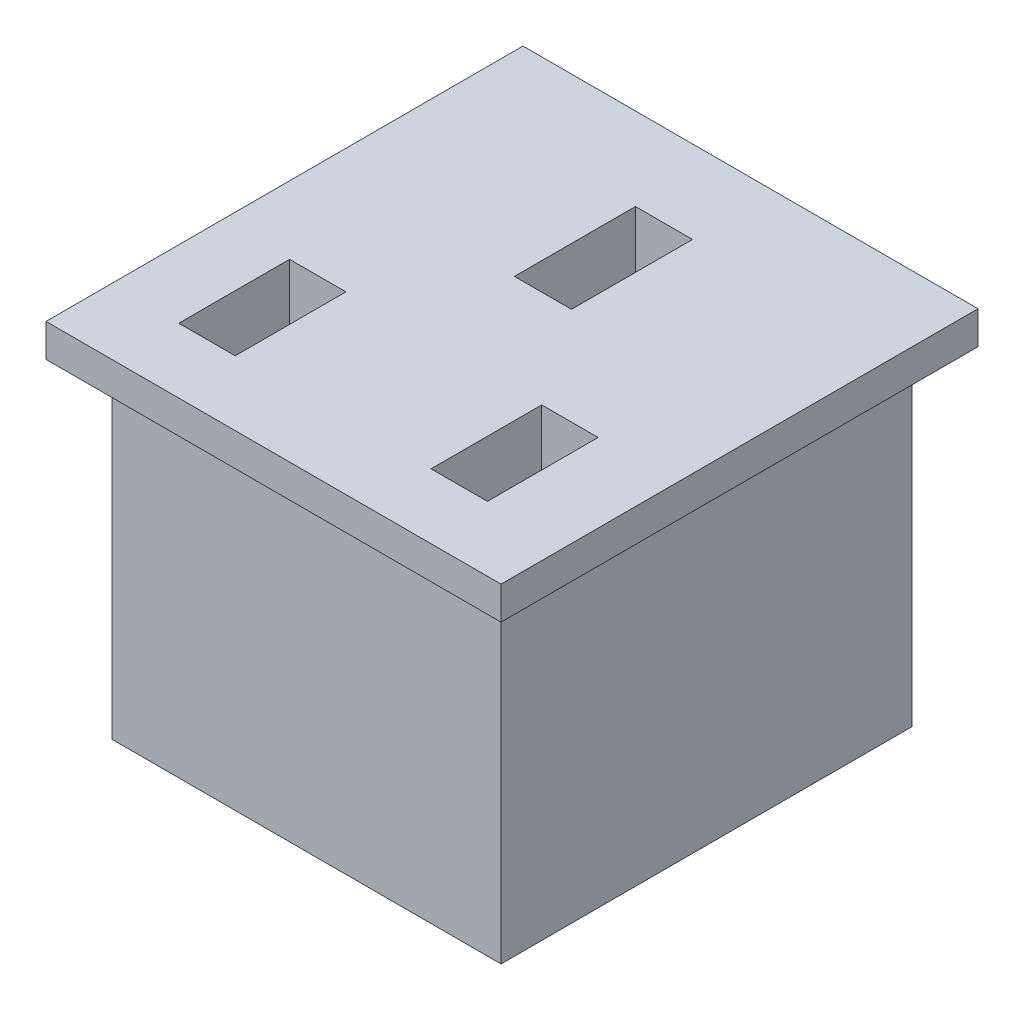
from build123d import *

# Parameters (mm, degrees)
SKETCH_1_W          = 35.5
SKETCH_1_H          = 37.5
EXTRUDE_1_DEPTH     = 30
SKETCH_2_W          = 41.5
SKETCH_2_H          = 43.5
EXTRUDE_2_DEPTH     = 3
SKETCH_4_W          = 5.142655321
SKETCH_4_H          = 10.097164716
SKETCH_4_W_2        = 5.20537063
SKETCH_4_H_2        = 11.037894348
CUT_EXTRUDE_1_DEPTH = 25


with BuildPart() as part:
    # 草图1 → 凸台-拉伸1 (new body)
    with BuildSketch(Plane(origin=(0, 0, 0), x_dir=(1, 0, 0), z_dir=(0, 1, 0))):
        Rectangle(SKETCH_1_W, SKETCH_1_H)
    extrude(amount=EXTRUDE_1_DEPTH)

    # 草图2 → 凸台-拉伸2 (add)
    with BuildSketch(Plane(origin=(0, 30, 0), x_dir=(1, 0, 0), z_dir=(0, 1, 0))):
        Rectangle(SKETCH_2_W, SKETCH_2_H)
    extrude(amount=EXTRUDE_2_DEPTH)

    # 草图4 → 切除-拉伸1 (cut)
    with BuildSketch(Plane(origin=(0, 33, 0), x_dir=(1, 0, 0), z_dir=(0, 1, 0))):
        with Locations((11.02137602, -10.787033113)):
            Rectangle(SKETCH_4_W, SKETCH_4_H)
        with Locations((-0.344934198, 8.686070268)):
            Rectangle(SKETCH_4_W_2, SKETCH_4_H_2)
        with Locations((-11.97862398, -10.787033113)):
            Rectangle(SKETCH_4_W, SKETCH_4_H)
    extrude(amount=-CUT_EXTRUDE_1_DEPTH, mode=Mode.SUBTRACT)


solid = part.part
